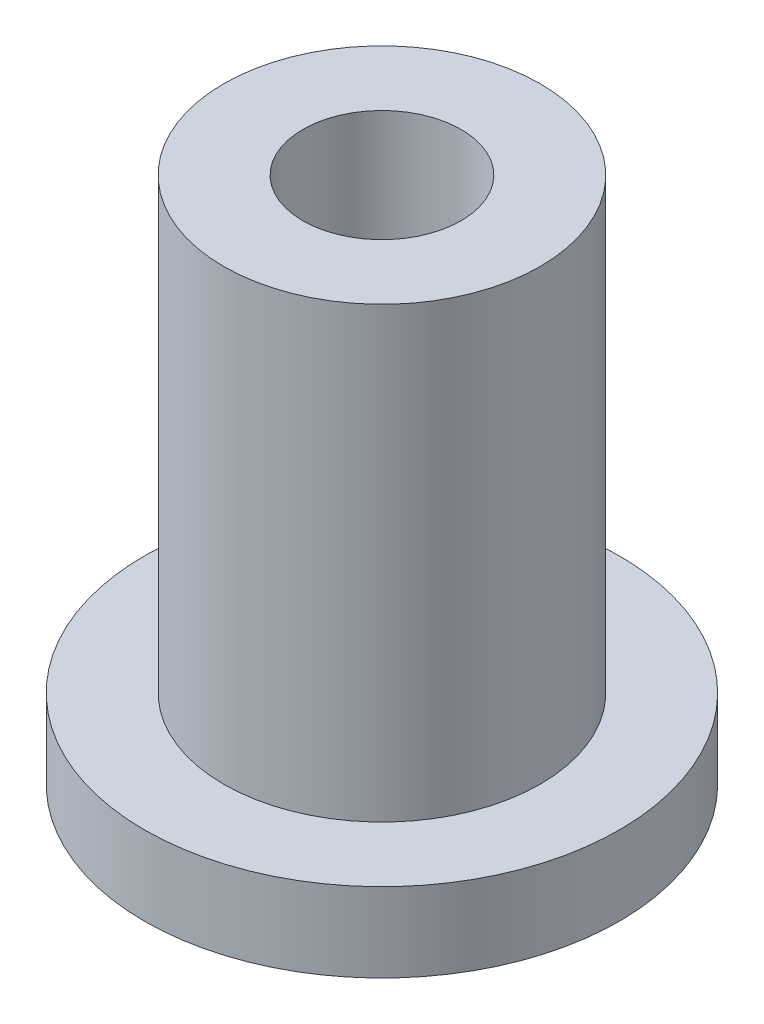
from build123d import *

# Parameters (mm, degrees)
CROQUIS1_R              = 4.5
CROQUIS1_R_2            = 1.5
SALIENTE_EXTRUIR1_DEPTH = 1.5
CROQUIS2_R              = 3
CROQUIS2_R_2            = 1.5
SALIENTE_EXTRUIR2_DEPTH = 8.5


with BuildPart() as part:
    # Croquis1 → Saliente-Extruir1 (new body)
    with BuildSketch(Plane(origin=(0, 0, 0), x_dir=(1, 0, 0), z_dir=(0, 1, 0))):
        with Locations(Location((0, 0, 0), (0, 0, 270))):
            Circle(CROQUIS1_R)
        with Locations(Location((0, 0, 0), (0, 0, 270))):
            Circle(CROQUIS1_R_2, mode=Mode.SUBTRACT)
    extrude(amount=SALIENTE_EXTRUIR1_DEPTH)

    # Croquis2 → Saliente-Extruir2 (add)
    with BuildSketch(Plane(origin=(0, 1.5, 0), x_dir=(1, 0, 0), z_dir=(0, 1, 0))):
        with Locations(Location((0, 0, 0), (0, 0, 270))):
            Circle(CROQUIS2_R)
        with Locations(Location((0, 0, 0), (0, 0, 270))):
            Circle(CROQUIS2_R_2, mode=Mode.SUBTRACT)
    extrude(amount=SALIENTE_EXTRUIR2_DEPTH)


solid = part.part
